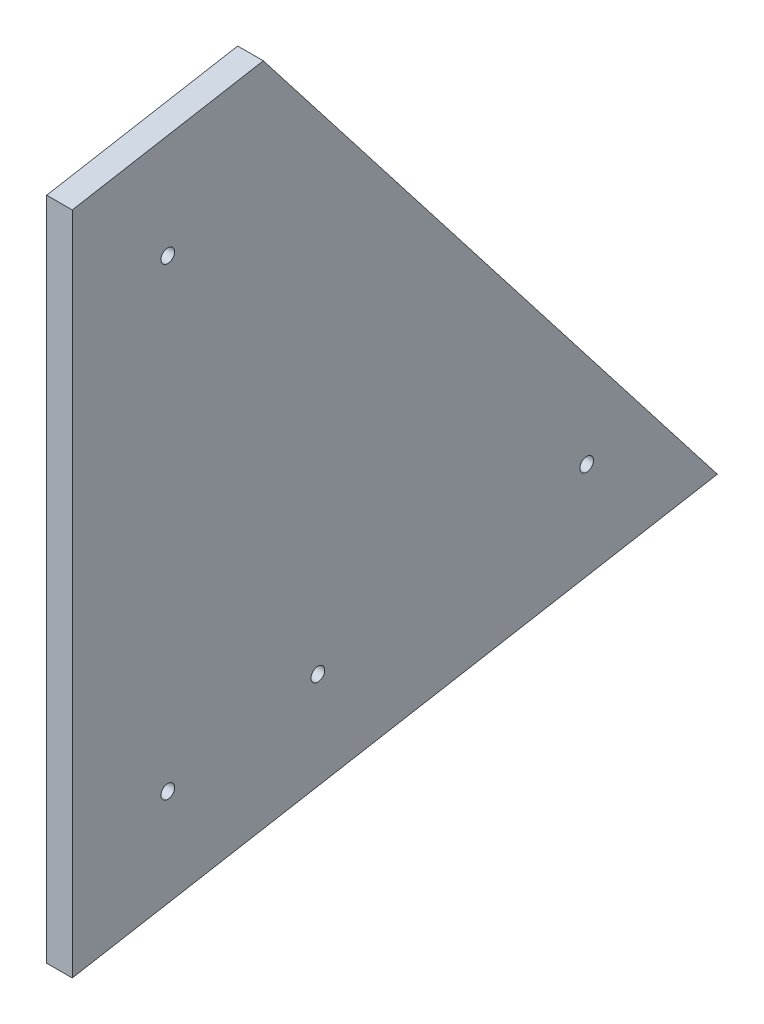
from build123d import *

# Parameters (mm, degrees)
BOSS_EXTRUDE1_DEPTH         = 11.90625
F_1_4_0_25_DIAMETER_HOLE1_D = 6.35


with BuildPart() as part:
    # Sketch1 → Boss-Extrude1 (new body)
    with BuildSketch(Plane(origin=(0, 0, 0), x_dir=(0, 0, -1), z_dir=(1, 0, 0))):
        Polygon((0, 0), (0, 309.502031303), (88.9, 325.177499888), (300.169403118, 52.927964553), align=None)
    extrude(amount=BOSS_EXTRUDE1_DEPTH)

    # 1/4 (0.25) Diameter Hole1 (through all)
    with Locations(Plane(origin=(11.90625, 0, 0), x_dir=(0, 0, -1), z_dir=(1, 0, 0))):
        with Locations((44.45, 52.973447191), (114.3, 65.289886793), (239.370584633, 87.343205357), (44.45, 268.873447191)):
            Hole(F_1_4_0_25_DIAMETER_HOLE1_D / 2)


solid = part.part
